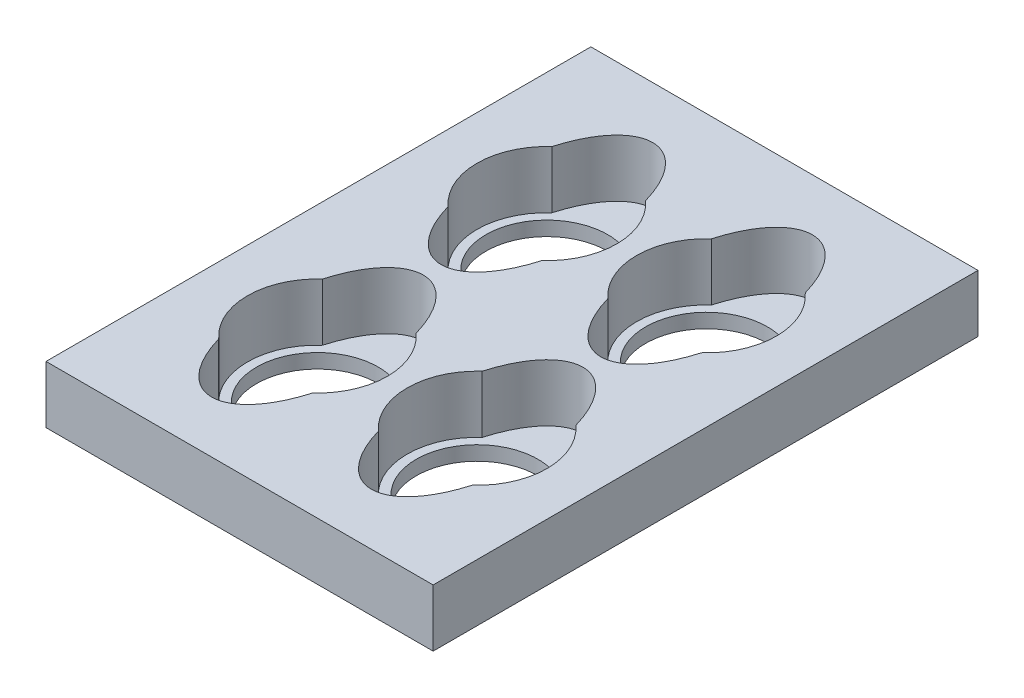
from build123d import *

# Parameters (mm, degrees)
SKETCH3_W           = 108
SKETCH3_H           = 152
BOSS_EXTRUDE1_DEPTH = 16
SKETCH7_W           = 98
SKETCH7_H           = 138
BOSS_EXTRUDE2_DEPTH = 4
SKETCH6_R           = 19.5
SKETCH6_RX          = 29.5
SKETCH6_RY          = 15
CUT_EXTRUDE2_DEPTH  = 16
SKETCH8_R           = 17
CUT_EXTRUDE3_DEPTH  = 10


with BuildPart() as part:
    # Sketch3 → Boss-Extrude1 (new body)
    with BuildSketch(Plane(origin=(0, 0, 0), x_dir=(1, 0, 0), z_dir=(0, 1, 0))):
        Rectangle(SKETCH3_W, SKETCH3_H)
    extrude(amount=BOSS_EXTRUDE1_DEPTH)

    # Sketch7 → Boss-Extrude2 (add)
    with BuildSketch(Plane.XZ):
        Rectangle(SKETCH7_W, SKETCH7_H)
    extrude(amount=BOSS_EXTRUDE2_DEPTH)

    # Sketch6 → Cut-Extrude2 (cut)
    with BuildSketch(Plane(origin=(0, 16, 0), x_dir=(1, 0, 0), z_dir=(0, 1, 0))):
        with Locations((22.271949374, 32)):
            Circle(SKETCH6_R)
        with Locations((22.271949374, -32)):
            Circle(SKETCH6_R)
        with Locations((-22.271949374, -32)):
            Circle(SKETCH6_R)
        with Locations((-22.271949374, 32)):
            Circle(SKETCH6_R)
        with Locations(Location((-22.271949374, 32), (0, 0, -90))):
            Ellipse(SKETCH6_RX, SKETCH6_RY)
        with Locations(Location((22.271949374, -32), (0, 0, -90))):
            Ellipse(SKETCH6_RX, SKETCH6_RY)
        with Locations(Location((-22.271949374, -32), (0, 0, -90))):
            Ellipse(SKETCH6_RX, SKETCH6_RY)
        with Locations(Location((22.271949374, 32), (0, 0, 90))):
            Ellipse(SKETCH6_RX, SKETCH6_RY)
    extrude(amount=-CUT_EXTRUDE2_DEPTH, mode=Mode.SUBTRACT)

    # Sketch8 → Cut-Extrude3 (cut)
    with BuildSketch(Plane(origin=(0, 0, 0), x_dir=(1, 0, 0), z_dir=(0, 1, 0))):
        with Locations(Location((-22.271949374, 32, 0), (0, 0, 270))):
            Circle(SKETCH8_R)
        with Locations(Location((22.271949374, 32, 0), (0, 0, 270))):
            Circle(SKETCH8_R)
        with Locations(Location((22.271949374, -32, 0), (0, 0, 270))):
            Circle(SKETCH8_R)
        with Locations(Location((-22.271949374, -32, 0), (0, 0, 270))):
            Circle(SKETCH8_R)
    extrude(amount=-CUT_EXTRUDE3_DEPTH, mode=Mode.SUBTRACT)


solid = part.part
